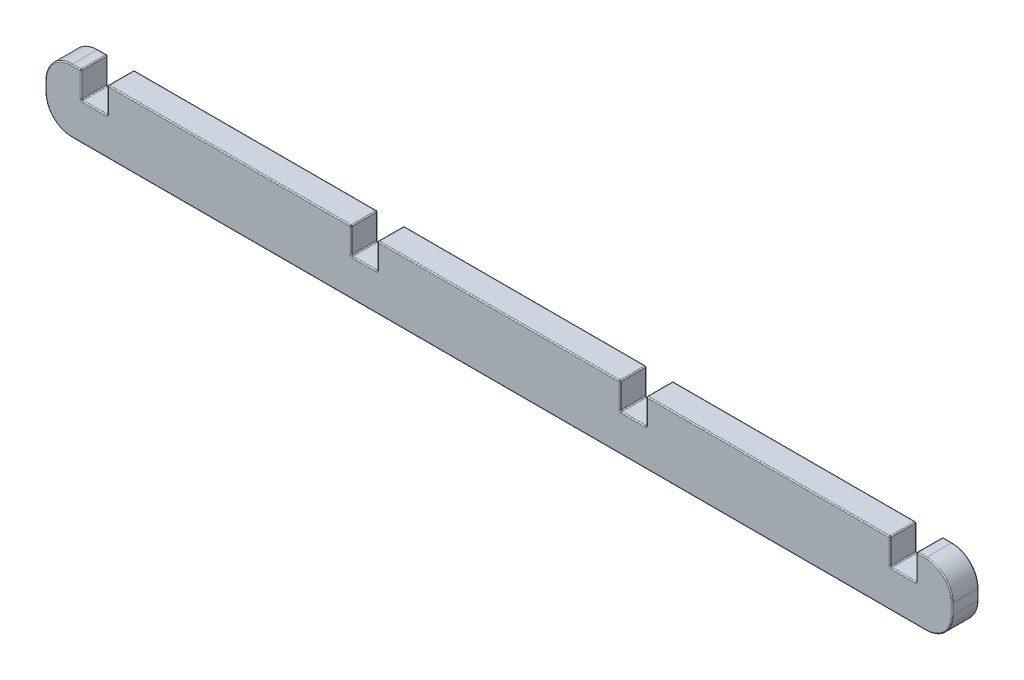
from build123d import *

# Parameters (mm, degrees)
RESSALTO_EXTRUS_O1_DEPTH = 2.5
FILETE1_R                = 0.1


with BuildPart() as part:
    # Esboço1 → Ressalto-extrusão1 (new body)
    with BuildSketch(Plane.XY):
        with BuildLine():
            Line((117.596836241, -148.014129344), (116.696836241, -148.014129344))
            ThreePointArc((116.696836241, -148.014129344), (114.929069288, -148.746362391), (114.196836241, -150.514129344))
            Line((114.196836241, -150.514129344), (114.196836241, -151.514129344))
            ThreePointArc((114.196836241, -151.514129344), (114.929069288, -153.281896297), (116.696836241, -154.014129344))
            Line((116.696836241, -154.014129344), (197.696836241, -154.014129344))
            ThreePointArc((197.696836241, -154.014129344), (199.464603194, -153.281896297), (200.196836241, -151.514129344))
            Line((200.196836241, -151.514129344), (200.196836241, -150.514129344))
            ThreePointArc((200.196836241, -150.514129344), (199.464603194, -148.746362391), (197.696836241, -148.014129344))
            Line((197.696836241, -148.014129344), (196.796836241, -148.014129344))
            Line((196.796836241, -148.014129344), (196.796836241, -150.514129344))
            Line((196.796836241, -150.514129344), (194.296836241, -150.514129344))
            Line((194.296836241, -150.514129344), (194.296836241, -148.014129344))
            Line((194.296836241, -148.014129344), (171.196836241, -148.014129344))
            Line((171.196836241, -148.014129344), (171.196836241, -150.514129344))
            Line((171.196836241, -150.514129344), (168.696836241, -150.514129344))
            Line((168.696836241, -150.514129344), (168.696836241, -148.014129344))
            Line((168.696836241, -148.014129344), (145.696836241, -148.014129344))
            Line((145.696836241, -148.014129344), (145.696836241, -150.514129344))
            Line((145.696836241, -150.514129344), (143.196836241, -150.514129344))
            Line((143.196836241, -150.514129344), (143.196836241, -148.014129344))
            Line((143.196836241, -148.014129344), (120.096836241, -148.014129344))
            Line((120.096836241, -148.014129344), (120.096836241, -150.514129344))
            Line((120.096836241, -150.514129344), (117.596836241, -150.514129344))
            Line((117.596836241, -150.514129344), (117.596836241, -148.014129344))
        make_face()
    extrude(amount=RESSALTO_EXTRUS_O1_DEPTH)

    # Filete1
    filete1_edges = [part.edges().sort_by_distance(p)[0] for p in [
        (157.196836241, -154.014129344, 2.5),
        (199.464603194, -153.281896297, 2.5),
        (200.196836241, -151.014129344, 2.5),
        (114.929069288, -148.746362391, 0),
        (117.146836241, -148.014129344, 0),
        (117.596836241, -149.264129344, 0),
        (118.846836241, -150.514129344, 0),
        (120.096836241, -149.264129344, 0),
        (199.464603194, -148.746362391, 2.5),
        (131.646836241, -148.014129344, 0),
        (143.196836241, -149.264129344, 0),
        (144.446836241, -150.514129344, 0),
        (145.696836241, -149.264129344, 0),
        (157.196836241, -148.014129344, 0),
        (168.696836241, -149.264129344, 0),
        (169.946836241, -150.514129344, 0),
        (171.196836241, -149.264129344, 0),
        (197.246836241, -148.014129344, 2.5),
        (182.746836241, -148.014129344, 0),
        (194.296836241, -149.264129344, 0),
        (195.546836241, -150.514129344, 0),
        (196.796836241, -149.264129344, 0),
        (197.246836241, -148.014129344, 0),
        (199.464603194, -148.746362391, 0),
        (200.196836241, -151.014129344, 0),
        (199.464603194, -153.281896297, 0),
        (196.796836241, -149.264129344, 2.5),
        (157.196836241, -154.014129344, 0),
        (114.929069288, -153.281896297, 0),
        (114.196836241, -151.014129344, 0),
        (195.546836241, -150.514129344, 2.5),
        (194.296836241, -149.264129344, 2.5),
        (117.596836241, -148.014129344, 1.25),
        (117.596836241, -150.514129344, 1.25),
        (120.096836241, -150.514129344, 1.25),
        (120.096836241, -148.014129344, 1.25),
        (143.196836241, -148.014129344, 1.25),
        (143.196836241, -150.514129344, 1.25),
        (145.696836241, -150.514129344, 1.25),
        (145.696836241, -148.014129344, 1.25),
        (168.696836241, -148.014129344, 1.25),
        (168.696836241, -150.514129344, 1.25),
        (171.196836241, -150.514129344, 1.25),
        (171.196836241, -148.014129344, 1.25),
        (194.296836241, -148.014129344, 1.25),
        (194.296836241, -150.514129344, 1.25),
        (196.796836241, -150.514129344, 1.25),
        (196.796836241, -148.014129344, 1.25),
        (182.746836241, -148.014129344, 2.5),
        (171.196836241, -149.264129344, 2.5),
        (114.196836241, -151.014129344, 2.5),
        (169.946836241, -150.514129344, 2.5),
        (168.696836241, -149.264129344, 2.5),
        (157.196836241, -148.014129344, 2.5),
        (145.696836241, -149.264129344, 2.5),
        (144.446836241, -150.514129344, 2.5),
        (143.196836241, -149.264129344, 2.5),
        (131.646836241, -148.014129344, 2.5),
        (120.096836241, -149.264129344, 2.5),
        (118.846836241, -150.514129344, 2.5),
        (117.596836241, -149.264129344, 2.5),
        (114.929069288, -153.281896297, 2.5),
        (117.146836241, -148.014129344, 2.5),
        (114.929069288, -148.746362391, 2.5),
    ]]
    fillet(filete1_edges, radius=FILETE1_R)


solid = part.part
